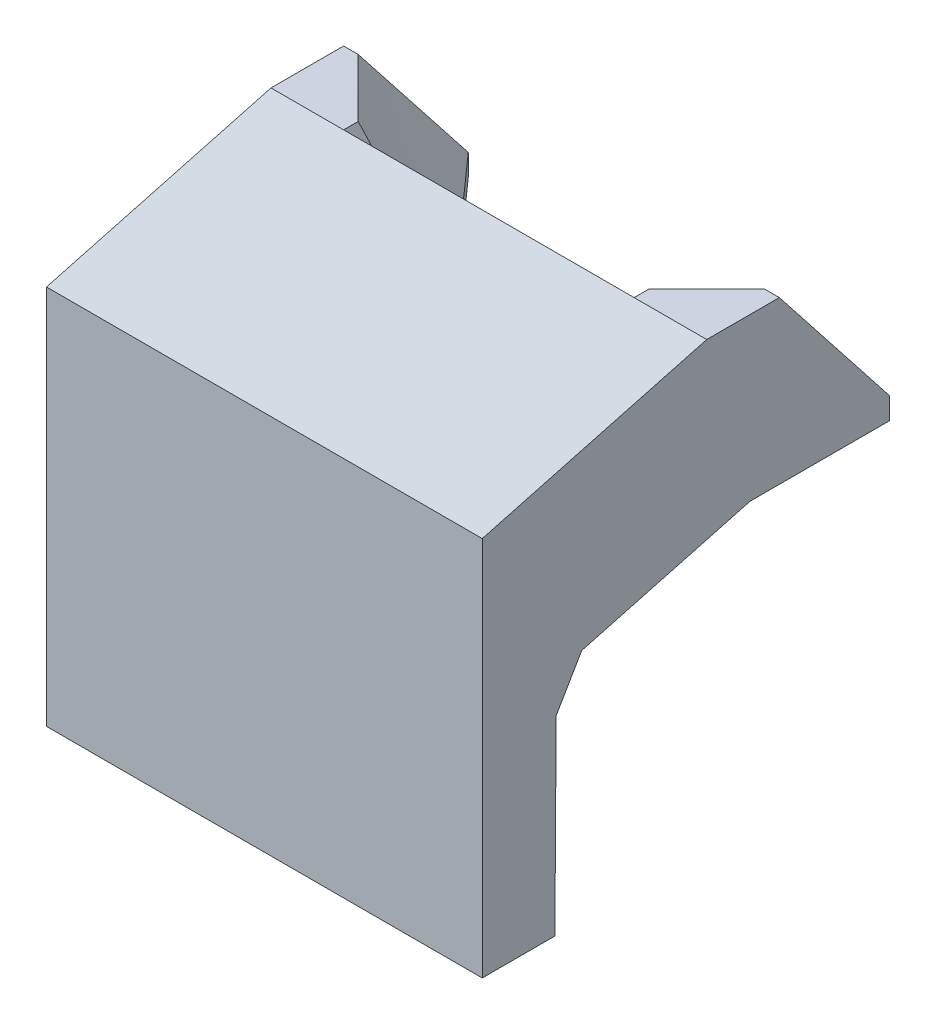
from build123d import *

# Parameters (mm, degrees)
BOSS_EXTRUDE1_DEPTH = 762
BOSS_EXTRUDE2_DEPTH = 38.1


with BuildPart() as part:
    # Sketch1 → Boss-Extrude1 (new body)
    with BuildSketch(Plane(origin=(0, 0, 0), x_dir=(0, 0, -1), z_dir=(1, 0, 0))):
        Polygon((46.92577301, 408.932434185), (341.339964863, 487.820479132), (265.552255804, 770.66405993), (-127, 665.48), (-127, 0), (0, 0), (2.243845254, 332.732434185), align=None)
    extrude(amount=BOSS_EXTRUDE1_DEPTH)

    # Sketch3 → Loft1 section 0
    with BuildSketch(Plane(origin=(0, 770.66405993, 0), x_dir=(1, 0, 0), z_dir=(0, 1, 0))):
        with BuildLine():
            Line((762, 265.552255804), (762, 392.552255804))
            Line((762, 392.552255804), (736.6, 392.552255804))
            Line((736.6, 392.552255804), (635, 290.952255804))
            Line((635, 290.952255804), (635, 265.552255804))
            Line((635, 265.552255804), (762, 265.552255804))
        make_face()
    # Sketch4 → Loft1 section 1
    with BuildSketch(Plane(origin=(0, 525.920479132, 0), x_dir=(1, 0, 0), z_dir=(0, 1, 0))):
        with BuildLine():
            Line((762, 331.131100631), (762, 585.131100631))
            Line((762, 585.131100631), (736.6, 585.131100631))
            Line((736.6, 585.131100631), (533.4, 356.531100631))
            Line((533.4, 356.531100631), (533.4, 331.131100631))
            Line((533.4, 331.131100631), (762, 331.131100631))
        make_face()
    loft1 = loft()

    # Sketch4<5> → Boss-Extrude2 (add)
    with BuildSketch(Plane(origin=(0, 525.920479132, 0), x_dir=(1, 0, 0), z_dir=(0, 1, 0))):
        Polygon((762, 331.131100631), (762, 585.131100631), (736.6, 585.131100631), (533.4, 356.531100631), (533.4, 331.131100631), align=None)
    boss_extrude2 = extrude(amount=-BOSS_EXTRUDE2_DEPTH)

    # Mirror1: Loft1, Boss-Extrude2 across plane
    add(loft1.mirror(Plane(origin=(381, 0, 0), x_dir=(0, 0, 1), z_dir=(1, 0, 0))))
    add(boss_extrude2.mirror(Plane(origin=(381, 0, 0), x_dir=(0, 0, 1), z_dir=(1, 0, 0))))


solid = part.part
